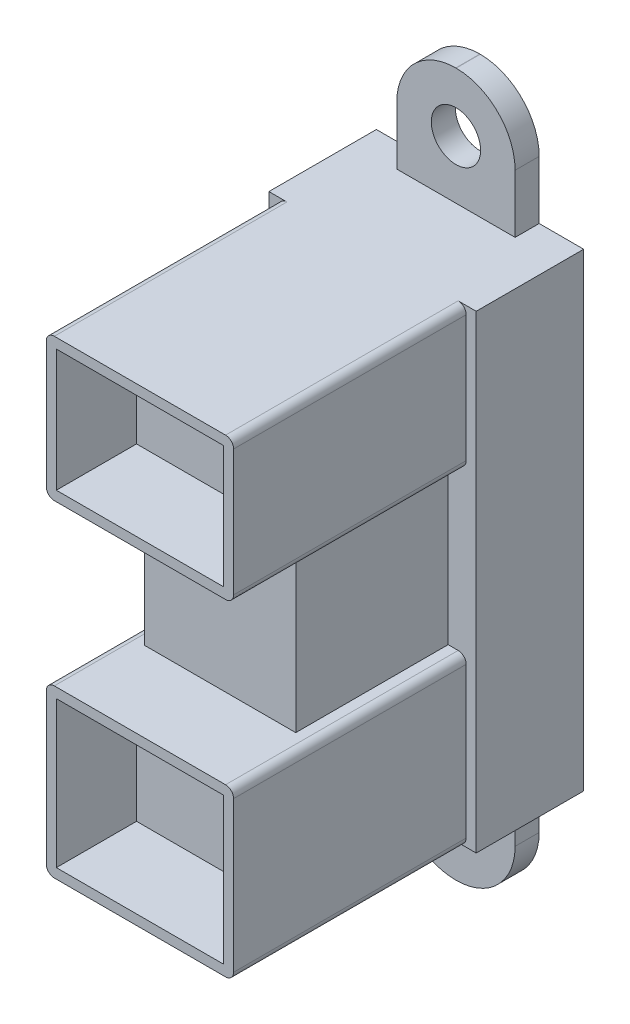
from build123d import *

# Parameters (mm, degrees)
SKETCH1_W          = 13.1318
SKETCH1_H          = 29.718
EXTRUDE1_DEPTH     = 21.5392
SKETCH2_W          = 0.635
SKETCH2_H          = 29.718
CUT_EXTRUDE1_DEPTH = 14.732
SKETCH3_W          = 11.8618
SKETCH3_H          = 10.16
CUT_EXTRUDE2_DEPTH = 5.08
SKETCH5_W          = 1.778
SKETCH5_H          = 10.16
CUT_EXTRUDE3_DEPTH = 36.674017425
FILLET1_R          = 0.508
SKETCH7_W          = 7.493
SKETCH7_H          = 7.4168
EXTRUDE4_DEPTH     = 1.524
FILLET3_R          = 3.7338
SKETCH9_R          = 1.5621
CUT_EXTRUDE4_DEPTH = 1.524
SKETCH11_W         = 10.5918
SKETCH11_H         = 7.747
CUT_EXTRUDE5_DEPTH = 5.08
SKETCH12_W         = 10.5918
SKETCH12_H         = 9.271
CUT_EXTRUDE6_DEPTH = 5.08
SKETCH13_W         = 9.271
SKETCH13_H         = 7.62
EXTRUDE5_DEPTH     = 6.35
CHAMFER1_SIZE      = 1.27
SKETCH14_W         = 6.35
SKETCH14_H         = 7.62
CUT_EXTRUDE7_DEPTH = 3.048
SKETCH15_W         = 1.7272
SKETCH15_H         = 5.969
SKETCH15_W_2       = 5.715
SKETCH15_H_2       = 7.112
SKETCH15_R         = 0.127
CUT_EXTRUDE8_DEPTH = 5.08


with BuildPart() as part:
    # Sketch1 → Extrude1 (new body)
    with BuildSketch(Plane.XY):
        with Locations((6.5659, 14.859)):
            Rectangle(SKETCH1_W, SKETCH1_H)
    extrude(amount=EXTRUDE1_DEPTH)

    # Sketch2 → Cut-Extrude1 (cut)
    with BuildSketch(Plane.XY.offset(21.5392)):
        with Locations((0.3175, 14.859)):
            Rectangle(SKETCH2_W, SKETCH2_H)
        with Locations((12.8143, 14.859)):
            Rectangle(SKETCH2_W, SKETCH2_H)
    extrude(amount=-CUT_EXTRUDE1_DEPTH, mode=Mode.SUBTRACT)

    # Sketch3 → Cut-Extrude2 (cut)
    with BuildSketch(Plane.XY.offset(21.5392)):
        with Locations((6.5659, 15.621)):
            Rectangle(SKETCH3_W, SKETCH3_H)
    extrude(amount=-CUT_EXTRUDE2_DEPTH, mode=Mode.SUBTRACT)

    # Sketch5 → Cut-Extrude3 (cut, through all)
    with BuildSketch(Plane.XY.offset(6.8072)):
        with Locations((0.889, 15.621)):
            Rectangle(SKETCH5_W, SKETCH5_H)
        with Locations((12.2428, 15.621)):
            Rectangle(SKETCH5_W, SKETCH5_H)
    extrude(amount=CUT_EXTRUDE3_DEPTH, mode=Mode.SUBTRACT)

    # Fillet1
    fillet1_edges = [part.edges().sort_by_distance(p)[0] for p in [
        (0.635, 29.718, 14.1732),
        (0.635, 0, 14.1732),
        (12.4968, 0, 14.1732),
        (12.4968, 29.718, 14.1732),
        (12.4968, 20.701, 14.1732),
        (12.4968, 10.541, 14.1732),
        (0.635, 10.541, 14.1732),
        (0.635, 20.701, 14.1732),
    ]]
    fillet(fillet1_edges, radius=FILLET1_R)

    # Sketch7 → Extrude4 (add)
    with BuildSketch(Plane(origin=(0, 0, 0), x_dir=(-1, 0, 0), z_dir=(0, 0, -1))):
        with Locations((-6.5659, 33.4264)):
            Rectangle(SKETCH7_W, SKETCH7_H)
        with Locations((-6.5659, -3.7084)):
            Rectangle(SKETCH7_W, SKETCH7_H)
    extrude(amount=-EXTRUDE4_DEPTH)

    # Fillet3
    fillet3_edges = [part.edges().sort_by_distance(p)[0] for p in [
        (10.3124, 37.1348, 0.762),
        (2.8194, 37.1348, 0.762),
        (10.3124, -7.4168, 0.762),
        (2.8194, -7.4168, 0.762),
    ]]
    fillet(fillet3_edges, radius=FILLET3_R)

    # Sketch9 → Cut-Extrude4 (cut)
    with BuildSketch(Plane(origin=(0, 0, 0), x_dir=(-1, 0, 0), z_dir=(0, 0, -1))):
        with Locations((-6.5659, 33.401)):
            Circle(SKETCH9_R)
        with Locations((-6.5659, -3.683)):
            Circle(SKETCH9_R)
    extrude(amount=-CUT_EXTRUDE4_DEPTH, mode=Mode.SUBTRACT)

    # Sketch11 → Cut-Extrude5 (cut)
    with BuildSketch(Plane.XY.offset(21.5392)):
        with Locations((6.5659, 25.2095)):
            Rectangle(SKETCH11_W, SKETCH11_H)
    extrude(amount=-CUT_EXTRUDE5_DEPTH, mode=Mode.SUBTRACT)

    # Sketch12 → Cut-Extrude6 (cut)
    with BuildSketch(Plane.XY.offset(21.5392)):
        with Locations((6.5659, 5.2705)):
            Rectangle(SKETCH12_W, SKETCH12_H)
    extrude(amount=-CUT_EXTRUDE6_DEPTH, mode=Mode.SUBTRACT)

    # Sketch13 → Extrude5 (add)
    with BuildSketch(Plane.ZY):
        with Locations((4.6355, 14.859)):
            Rectangle(SKETCH13_W, SKETCH13_H)
    extrude(amount=EXTRUDE5_DEPTH)

    # Chamfer1
    chamfer1_edges = [part.edges().sort_by_distance(p)[0] for p in [
        (0, 14.859, 9.271),
    ]]
    chamfer(chamfer1_edges, length=CHAMFER1_SIZE)

    # Sketch14 → Cut-Extrude7 (cut)
    with BuildSketch(Plane(origin=(0, 0, 0), x_dir=(-1, 0, 0), z_dir=(0, 0, -1))):
        with Locations((3.175, 14.859)):
            Rectangle(SKETCH14_W, SKETCH14_H)
    extrude(amount=-CUT_EXTRUDE7_DEPTH, mode=Mode.SUBTRACT)

    # Sketch15 → Cut-Extrude8 (cut)
    # profile 1 of 2: a face of its own
    with BuildSketch(Plane.ZY.offset(6.35)):
        with Locations((3.4036, 24.1935)):
            Rectangle(SKETCH15_W, SKETCH15_H)
    # profile 2 of 2: a face of its own
    with BuildSketch(Plane.ZY.offset(6.35)):
        with Locations((6.1595, 14.859)):
            Rectangle(SKETCH15_W_2, SKETCH15_H_2)
        with Locations((7.76066841, 14.859)):
            Circle(SKETCH15_R, mode=Mode.SUBTRACT)
        with Locations((7.76066841, 17.399)):
            Circle(SKETCH15_R, mode=Mode.SUBTRACT)
        with Locations((7.76066841, 12.319)):
            Circle(SKETCH15_R, mode=Mode.SUBTRACT)
    extrude(amount=-CUT_EXTRUDE8_DEPTH, mode=Mode.SUBTRACT)


solid = part.part
